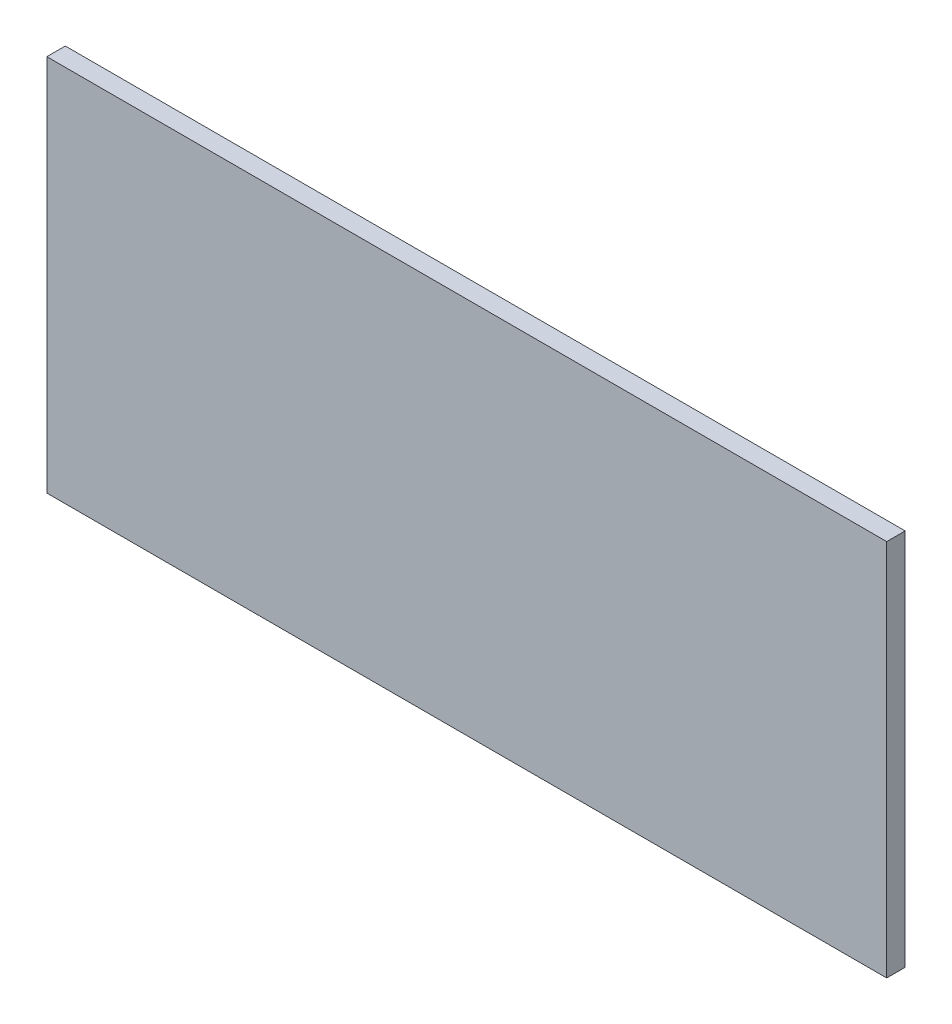
from build123d import *

# Parameters (mm, degrees)
BOSS_EXTRUDE1_START = -3880
SKETCH1_W           = 80000
SKETCH1_H           = 36000
BOSS_EXTRUDE1_DEPTH = 1760


with BuildPart() as part:
    # Sketch1 → Boss-Extrude1 (new body)
    with BuildSketch(Plane.XY.offset(BOSS_EXTRUDE1_START)):
        with Locations((7918.087599311, -2142.692095945)):
            Rectangle(SKETCH1_W, SKETCH1_H)
    extrude(amount=-BOSS_EXTRUDE1_DEPTH)


solid = part.part
